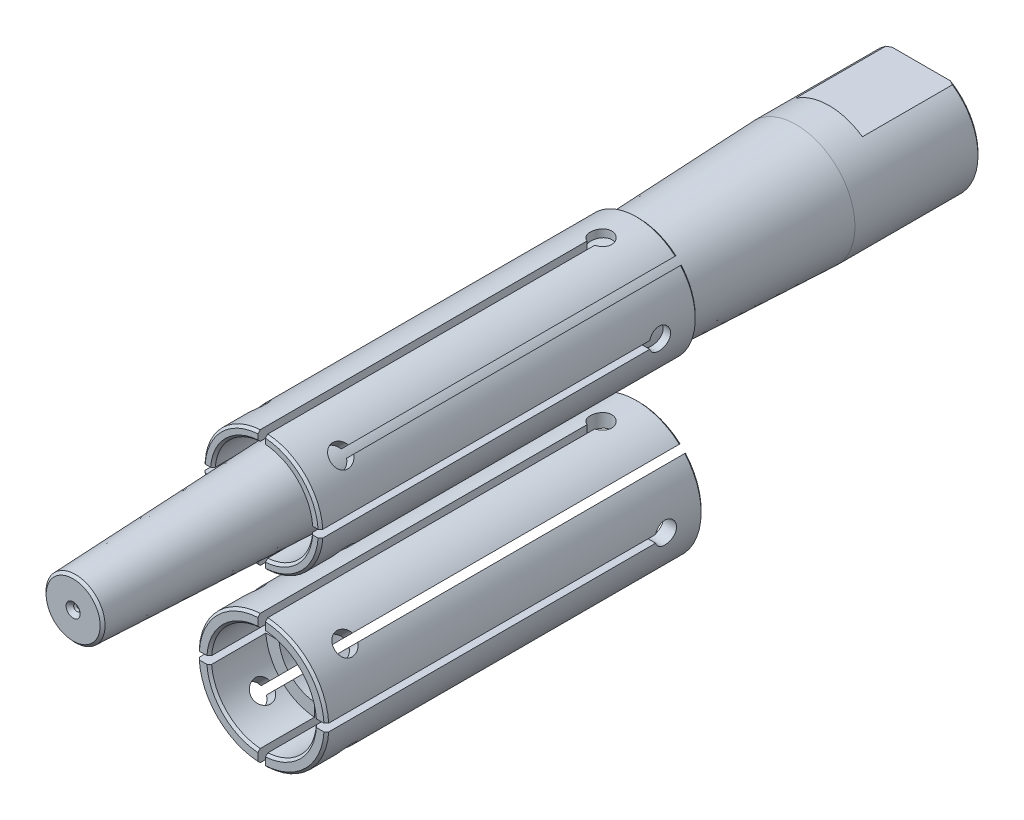
from build123d import *
from OCP.BRepFilletAPI import BRepFilletAPI_MakeChamfer

# Parameters (mm, degrees)
CUT_EXTRUDE1_DEPTH       = 132.158631292
CUT_EXTRUDE1_DEPTH_BACK  = 132.158631292
SKETCH3_W                = 24.892
SKETCH3_H                = 2.794
CHAMFER2_SIZE            = 0.635
CHAMFER3_SIZE            = 0.635
CUT_EXTRUDE2_DEPTH       = 132.158631292
CUT_EXTRUDE3_DEPTH       = 132.158631292
CIRPATTERN1_COUNT        = 2
CIRPATTERN1_ANGLE        = 90
LPATTERN2_COUNT          = 2
LPATTERN2_PITCH          = 44.45
CIRPATTERN2_COPY_1_DEPTH = 132.158631292
CIRPATTERN2_COPY_2_DEPTH = 132.158631292
CHAMFER1_SIZE            = 0.635
CHAMFER1_SIZE2           = 0.662519988


with BuildPart() as part:
    # Sketch2 → Revolve1 (revolve)
    with BuildSketch(Plane(origin=(0, 0, 0), x_dir=(0, 0, -1), z_dir=(1, 0, 0)), mode=Mode.PRIVATE) as revolve1_sk:
        Polygon((109.22, 0), (-111.60125, 0), (-112.49025, 0.889), (-113.284, 0.889), (-114.3, 1.905), (-114.3, 7.9375), (80.518, 15.875), (114.3, 15.875), (114.3, 2.54), (111.76, 2.54), align=None)
    revolve(revolve1_sk.sketch.rotate(Axis((0, 0, 1114.3), (0, 0, -1)), 90), axis=Axis((0, 0, 1114.3), (0, 0, -1)))

    # Sketch3 → Cut-Extrude1 (cut, two sides: drawn at the far end of the back side and taken through both)
    with BuildSketch(Plane(origin=(0, 0, 0), x_dir=(0, 0, -1), z_dir=(1, 0, 0)).offset(-CUT_EXTRUDE1_DEPTH_BACK)):
        with Locations((101.854, 14.478)):
            Rectangle(SKETCH3_W, SKETCH3_H)
    extrude(amount=CUT_EXTRUDE1_DEPTH + CUT_EXTRUDE1_DEPTH_BACK, mode=Mode.SUBTRACT)

    # Chamfer1: one chamfer whose edges measure the first distance from different faces: ONE call of the kernel's chamfer builder (chamfer() names one face for all edges)
    chamfer1_edges_1 = [part.edges().sort_by_distance(p)[0] for p in [
        (-7.9375, 0, 114.3),
    ]]
    chamfer1_side_1 = [part.faces().sort_by_distance(p)[0] for p in [
        (-11.90625, 0, 16.891),
    ]]
    chamfer1_edges_2 = [part.edges().sort_by_distance(p)[0] for p in [
        (-2.54, 0, -114.3),
        (-7.390065722, -14.050001908, -114.3),
    ]]
    chamfer1 = BRepFilletAPI_MakeChamfer(part.part.solid().wrapped)
    for e in chamfer1_edges_1:
        chamfer1.Add(CHAMFER1_SIZE, CHAMFER1_SIZE2, e.wrapped, chamfer1_side_1[0].wrapped)  # the first distance lies on this face
    for e in chamfer1_edges_2:
        chamfer1.Add(CHAMFER1_SIZE, e.wrapped)
    add(Compound.cast(chamfer1.Shape()), mode=Mode.REPLACE)


with BuildPart() as body_2:
    # Sketch2<3> → Revolve2 (revolve)
    with BuildSketch(Plane(origin=(0, 0, 0), x_dir=(0, 0, -1), z_dir=(1, 0, 0)), mode=Mode.PRIVATE) as revolve2_sk:
        Polygon((-48.259238, 10.628209012), (38.1, 14.146756845), (38.1, 15.875), (-63.5, 15.875), (-63.5, 13.168209012), (-48.259238, 13.168209012), align=None)
    revolve(revolve2_sk.sketch.rotate(Axis((0, 0, 1114.3), (0, 0, -1)), 90), axis=Axis((0, 0, 1114.3), (0, 0, -1)))

    # Chamfer2
    chamfer2_edges = [body_2.edges().sort_by_distance(p)[0] for p in [
        (-13.168209012, 0, 63.5),
        (-15.875, 0, 63.5),
        (-15.875, 0, -38.1),
    ]]
    chamfer(chamfer2_edges, length=CHAMFER2_SIZE)

    # Sketch4 → Cut-Extrude2 (cut, symmetric)
    with BuildSketch(Plane(origin=(0, 0, 0), x_dir=(0, 0, -1), z_dir=(1, 0, 0))):
        with BuildLine():
            Line((-63.5, -1.016), (-63.5, 1.016))
            Line((-63.5, 1.016), (25.228497951, 1.016))
            ThreePointArc((25.228497951, 1.016), (30.8356, 0), (25.228497951, -1.016))
            Line((25.228497951, -1.016), (-63.5, -1.016))
        make_face()
    cut_extrude2 = extrude(amount=CUT_EXTRUDE2_DEPTH, both=True, mode=Mode.SUBTRACT)

    # Sketch5 → Cut-Extrude3 (cut, symmetric)
    with BuildSketch(Plane(origin=(0, 0, 0), x_dir=(0, 0, -1), z_dir=(0.7071067811865488, 0.7071067811865464, 0))):
        with BuildLine():
            Line((38.1, -1.016), (38.1, 1.016))
            Line((38.1, 1.016), (-50.628497951, 1.016))
            ThreePointArc((-50.628497951, 1.016), (-56.2356, 0), (-50.628497951, -1.016))
            Line((-50.628497951, -1.016), (38.1, -1.016))
        make_face()
    cut_extrude3 = extrude(amount=CUT_EXTRUDE3_DEPTH, both=True, mode=Mode.SUBTRACT)

    # CirPattern1: Cut-Extrude2, Cut-Extrude3 ×2 about axis
    cirpattern1_axis = Axis((0, 0, 0), (0, 0, -1))
    add([cut_extrude2.rotate(cirpattern1_axis, i * CIRPATTERN1_ANGLE / (CIRPATTERN1_COUNT - 1)) for i in range(1, CIRPATTERN1_COUNT)], mode=Mode.SUBTRACT)
    add([cut_extrude3.rotate(cirpattern1_axis, i * CIRPATTERN1_ANGLE / (CIRPATTERN1_COUNT - 1)) for i in range(1, CIRPATTERN1_COUNT)], mode=Mode.SUBTRACT)


with BuildPart() as body_3:
    # Sketch7 → Revolve3 (revolve)
    with BuildSketch(Plane(origin=(0, 0, 0), x_dir=(0, 0, -1), z_dir=(1, 0, 0))):
        Polygon((-63.5, -30.303243155), (-63.5, -26.9875), (38.1, -26.9875), (38.1, -30.303243155), (-48.259238, -33.821790988), (-48.259238, -30.303243155), align=None)
    revolve(axis=Axis((0, -44.45, -109.22), (0, 0, 1)))

    # Chamfer3
    chamfer3_edges = [body_3.edges().sort_by_distance(p)[0] for p in [
        (0, -61.9125, 63.5),
        (0, -58.596756845, 63.5),
        (0, -61.9125, -38.1),
    ]]
    chamfer(chamfer3_edges, length=CHAMFER3_SIZE)

    # LPattern2: Cut-Extrude2, Cut-Extrude3 ×2
    with Locations(*[(0, -i * LPATTERN2_PITCH, 0) for i in range(1, LPATTERN2_COUNT)]):
        add(cut_extrude2, mode=Mode.SUBTRACT)
        add(cut_extrude3, mode=Mode.SUBTRACT)

    # CirPattern2 copy 1 sketch → CirPattern2 copy 1 (cut, symmetric)
    with BuildSketch(Plane(origin=(0, -44.45, 0), x_dir=(0, 0, -1), z_dir=(0, 1, 0))):
        with BuildLine():
            Line((-63.5, -1.016), (-63.5, 1.016))
            Line((-63.5, 1.016), (25.228497951, 1.016))
            ThreePointArc((25.228497951, 1.016), (30.8356, 0), (25.228497951, -1.016))
            Line((25.228497951, -1.016), (-63.5, -1.016))
        make_face()
    extrude(amount=CIRPATTERN2_COPY_1_DEPTH, both=True, mode=Mode.SUBTRACT)

    # CirPattern2 copy 2 sketch → CirPattern2 copy 2 (cut, symmetric)
    with BuildSketch(Plane(origin=(0, -44.45, 0), x_dir=(0, 0, -1), z_dir=(-0.7071067811865488, 0.7071067811865464, 0))):
        with BuildLine():
            Line((38.1, -1.016), (38.1, 1.016))
            Line((38.1, 1.016), (-50.628497951, 1.016))
            ThreePointArc((-50.628497951, 1.016), (-56.2356, 0), (-50.628497951, -1.016))
            Line((-50.628497951, -1.016), (38.1, -1.016))
        make_face()
    extrude(amount=CIRPATTERN2_COPY_2_DEPTH, both=True, mode=Mode.SUBTRACT)


solid = Compound([part.part, body_2.part, body_3.part])
